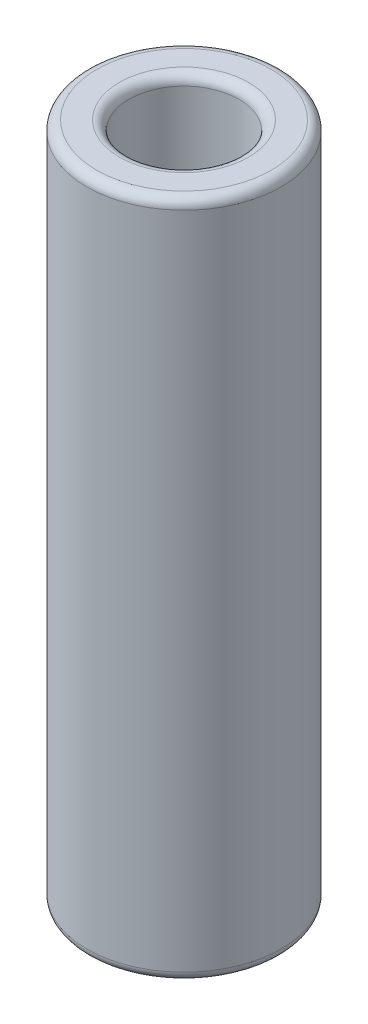
from build123d import *

# Parameters (mm, degrees)
SKETCH1_R           = 3
SKETCH1_R_2         = 1.7
BOSS_EXTRUDE1_DEPTH = 21
FILLET1_R           = 0.3


with BuildPart() as part:
    # Sketch1 → Boss-Extrude1 (new body)
    with BuildSketch(Plane(origin=(0, 0, 0), x_dir=(1, 0, 0), z_dir=(0, 1, 0))):
        with Locations(Location((0, 0, 0), (0, 0, 90))):
            Circle(SKETCH1_R)
        with Locations(Location((0, 0, 0), (0, 0, 90))):
            Circle(SKETCH1_R_2, mode=Mode.SUBTRACT)
    extrude(amount=BOSS_EXTRUDE1_DEPTH)

    # Fillet1
    fillet1_edges = [part.edges().sort_by_distance(p)[0] for p in [
        (0, 0, 3),
        (0, 21, 3),
        (0, 0, 1.7),
        (0, 21, 1.7),
    ]]
    fillet(fillet1_edges, radius=FILLET1_R)


solid = part.part
